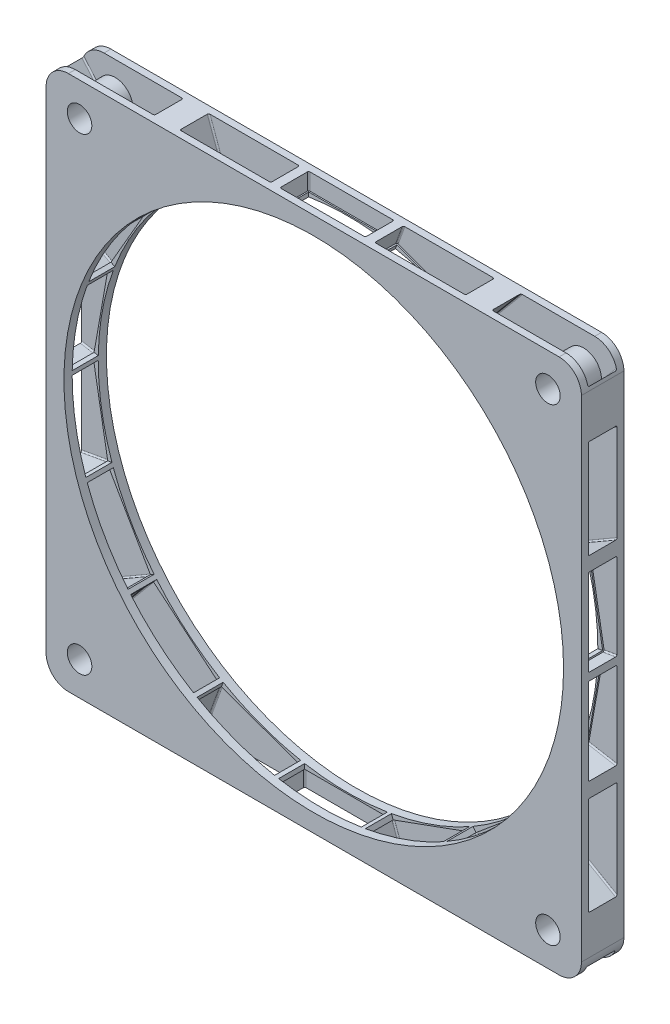
from build123d import *
from build123d.topology import SkipClean

# Parameters (mm, degrees)
SKETCH1_R                      = 56
SKETCH1_R_2                    = 2.75
BOSS_EXTRUDE1_DEPTH            = 4.7625
CUT_EXTRUDE5_REACH             = 133.116
SKETCH6_W                      = 18.542
SKETCH6_H                      = 5.842
CUT_EXTRUDE5_DIRECTION_2_DEPTH = 132.115979863
CUT_EXTRUDE6_DEPTH             = 132.115979863
CIRPATTERN9_COUNT              = 18
BOSS_EXTRUDE2_REACH            = 87.228
SKETCH8_R                      = 4
SKETCH8_R_2                    = 2.75
CIRPATTERN10_COUNT             = 4


with BuildPart() as part:
    # Sketch1 → Boss-Extrude1 (new, symmetric)
    with BuildSketch(Plane.XY):
        with BuildLine():
            Line((-55, -60), (55, -60))
            ThreePointArc((55, -60), (58.535533906, -58.535533906), (60, -55))
            Line((60, -55), (60, 55))
            ThreePointArc((60, 55), (58.535533906, 58.535533906), (55, 60))
            Line((55, 60), (-55, 60))
            ThreePointArc((-55, 60), (-58.535533906, 58.535533906), (-60, 55))
            Line((-60, 55), (-60, -55))
            ThreePointArc((-60, -55), (-58.535533906, -58.535533906), (-55, -60))
        make_face()
        with Locations(Location((0, 0, 0), (0, 0, 180))):
            Circle(SKETCH1_R, mode=Mode.SUBTRACT)
        with Locations(Location((-52.5, 52.5, 0), (0, 0, 180))):
            Circle(SKETCH1_R_2, mode=Mode.SUBTRACT)
        with Locations(Location((52.5, 52.5, 0), (0, 0, 180))):
            Circle(SKETCH1_R_2, mode=Mode.SUBTRACT)
        with Locations(Location((52.5, -52.5, 0), (0, 0, 180))):
            Circle(SKETCH1_R_2, mode=Mode.SUBTRACT)
        with Locations(Location((-52.5, -52.5, 0), (0, 0, 180))):
            Circle(SKETCH1_R_2, mode=Mode.SUBTRACT)
    extrude(amount=BOSS_EXTRUDE1_DEPTH, both=True)

    # Sketch6 → Cut-Extrude5 (cut, up to next)
    with BuildSketch(Plane(origin=(-0.446060693, -56.254, 0), x_dir=(1, 0, 0), z_dir=(0, -1, 0)), mode=Mode.PRIVATE) as cut_extrude5_sk1:
        Rectangle(SKETCH6_W, SKETCH6_H)
    cut_extrude5_tool1 = extrude(cut_extrude5_sk1.sketch, amount=-CUT_EXTRUDE5_REACH, mode=Mode.PRIVATE) & part.part
    cut_extrude5 = cut_extrude5_tool1.solids().sort_by_distance((-0.446061, -56.254, 0))[0]
    add(cut_extrude5, mode=Mode.SUBTRACT)

    # Sketch6 → Cut-Extrude5 direction 2 (cut)
    with BuildSketch(Plane(origin=(-0.446060693, -56.254, 0), x_dir=(1, 0, 0), z_dir=(0, -1, 0))):
        Rectangle(SKETCH6_W, SKETCH6_H)
    cut_extrude5_direction_2 = extrude(amount=CUT_EXTRUDE5_DIRECTION_2_DEPTH, mode=Mode.SUBTRACT)

    # Sketch7 → Cut-Extrude6 (cut, through all)
    with BuildSketch(Plane(origin=(-0.446060693, -56.254, 0), x_dir=(1, 0, 0), z_dir=(0, -1, 0))):
        with BuildLine():
            Line((9.575, -2.921), (9.575, 2.921))
            ThreePointArc((9.575, 2.921), (9.485960461, 3.135960461), (9.271, 3.225))
            Line((9.271, 3.225), (-9.271, 3.225))
            ThreePointArc((-9.271, 3.225), (-9.485960461, 3.135960461), (-9.575, 2.921))
            Line((-9.575, 2.921), (-9.575, -2.921))
            ThreePointArc((-9.575, -2.921), (-9.485960461, -3.135960461), (-9.271, -3.225))
            Line((-9.271, -3.225), (9.271, -3.225))
            ThreePointArc((9.271, -3.225), (9.485960461, -3.135960461), (9.575, -2.921))
        make_face()
    cut_extrude6 = extrude(amount=CUT_EXTRUDE6_DEPTH, mode=Mode.SUBTRACT)

    # CirPattern9: Cut-Extrude5, Cut-Extrude5 direction 2, Cut-Extrude6 ×18 about axis
    cirpattern9_axis = Axis((0, 0, 0), (0, 0, 1))
    add([cut_extrude5.rotate(cirpattern9_axis, i * 360 / CIRPATTERN9_COUNT) for i in range(1, CIRPATTERN9_COUNT)], mode=Mode.SUBTRACT)
    add([cut_extrude5_direction_2.rotate(cirpattern9_axis, i * 360 / CIRPATTERN9_COUNT) for i in range(1, CIRPATTERN9_COUNT)], mode=Mode.SUBTRACT)
    add([cut_extrude6.rotate(cirpattern9_axis, i * 360 / CIRPATTERN9_COUNT) for i in range(1, CIRPATTERN9_COUNT)], mode=Mode.SUBTRACT)

    # Sketch8 → Boss-Extrude2 (add, up to next)
    with BuildSketch(Plane(origin=(0, 0, 3.225), x_dir=(-1, 0, 0), z_dir=(0, 0, -1)), mode=Mode.PRIVATE) as boss_extrude2_sk1:
        with Locations((-52.5, 52.5)):
            Circle(SKETCH8_R)
        with Locations((-52.5, 52.5)):
            Circle(SKETCH8_R_2, mode=Mode.SUBTRACT)
    boss_extrude2_tool1 = extrude(boss_extrude2_sk1.sketch, amount=BOSS_EXTRUDE2_REACH, mode=Mode.PRIVATE) - part.part
    boss_extrude2 = boss_extrude2_tool1.solids().sort_by_distance((56.386863, 52.5, 3.225))[0]
    add(boss_extrude2)

    # CirPattern10: Boss-Extrude2; each copy of Boss-Extrude2 runs up to whatever stops it at its own place
    with SkipClean():  # the faces are left unmerged after this step: merging them gives an invalid solid
        cirpattern10_before = part.part  # the part as the pattern finds it: every copy runs up to it
        cirpattern10_boss_extrude2_long = extrude(boss_extrude2_sk1.sketch, amount=BOSS_EXTRUDE2_REACH, mode=Mode.PRIVATE)
        cirpattern10_boss_extrude2_tool1 = cirpattern10_boss_extrude2_long.rotate(Axis((0, 0, 0), (0, 0, 1)), 1 * 360 / CIRPATTERN10_COUNT) - cirpattern10_before
        add(cirpattern10_boss_extrude2_tool1.solids().sort_by_distance((-52.5, 56.386863, 3.225))[0])
        cirpattern10_boss_extrude2_tool2 = cirpattern10_boss_extrude2_long.rotate(Axis((0, 0, 0), (0, 0, 1)), 2 * 360 / CIRPATTERN10_COUNT) - cirpattern10_before
        add(cirpattern10_boss_extrude2_tool2.solids().sort_by_distance((-56.386863, -52.5, 3.225))[0])
        cirpattern10_boss_extrude2_tool3 = cirpattern10_boss_extrude2_long.rotate(Axis((0, 0, 0), (0, 0, 1)), 3 * 360 / CIRPATTERN10_COUNT) - cirpattern10_before
        add(cirpattern10_boss_extrude2_tool3.solids().sort_by_distance((52.5, -56.386863, 3.225))[0])


solid = part.part
